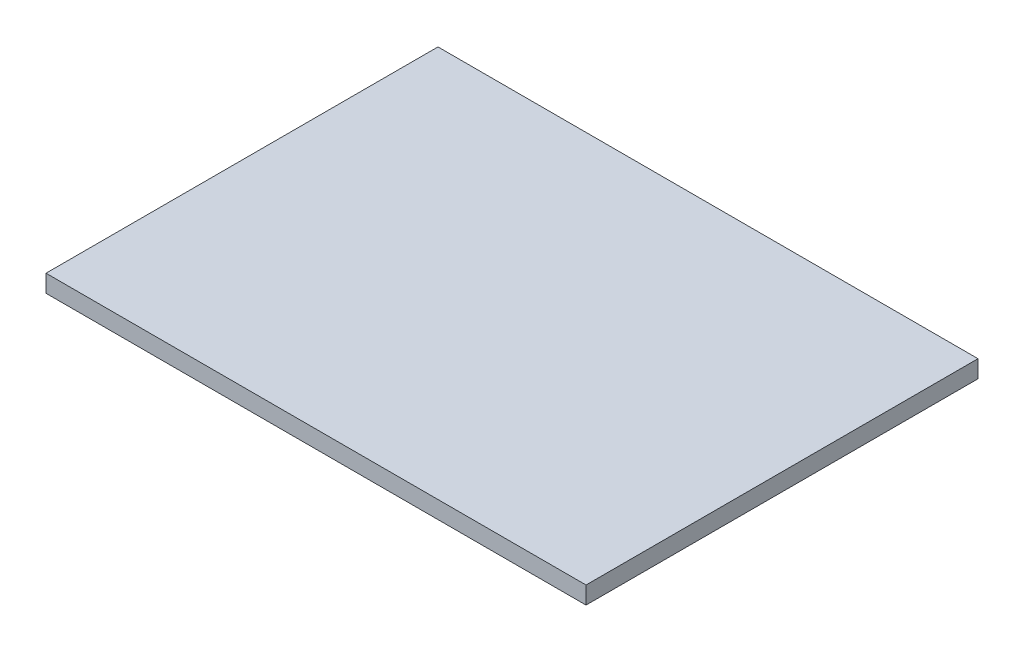
from build123d import *

# Parameters (mm, degrees)
SKETCH1_W           = 62
SKETCH1_H           = 45
BOSS_EXTRUDE1_DEPTH = 2


with BuildPart() as part:
    # Sketch1 → Boss-Extrude1 (new body)
    with BuildSketch(Plane(origin=(0, 0, 0), x_dir=(1, 0, 0), z_dir=(0, 1, 0))):
        Rectangle(SKETCH1_W, SKETCH1_H)
    extrude(amount=BOSS_EXTRUDE1_DEPTH)


solid = part.part
